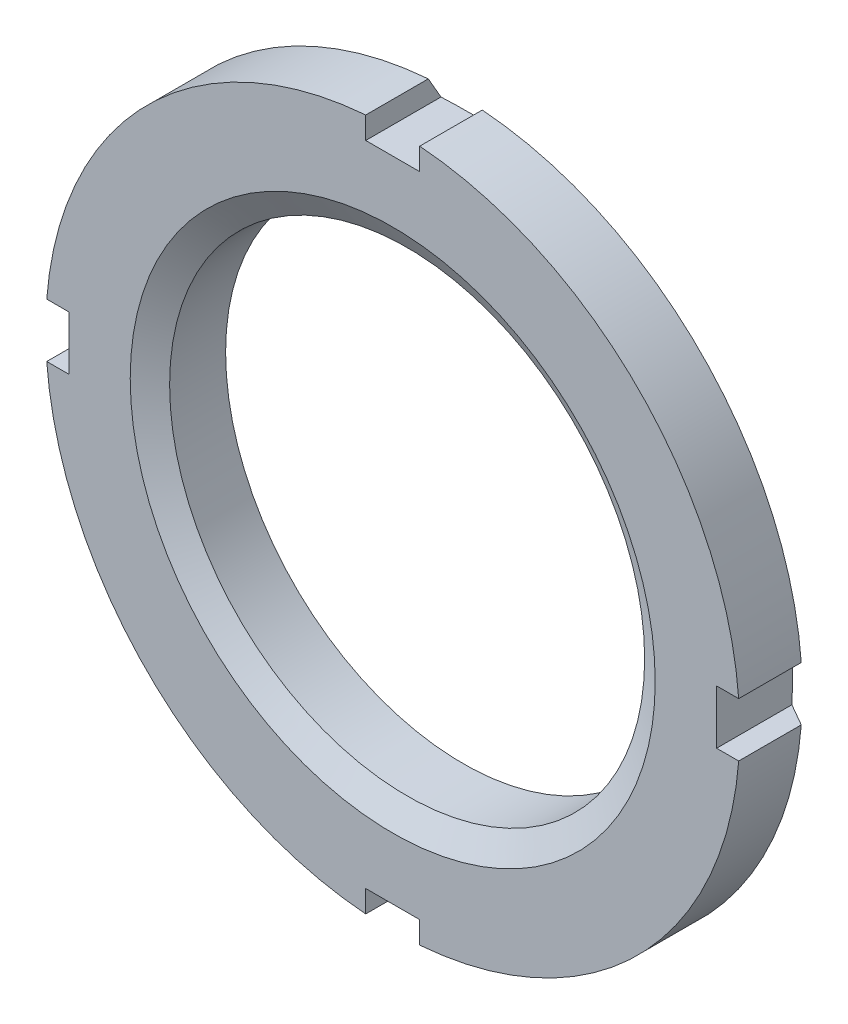
from build123d import *

# Parameters (mm, degrees)
SKICA1_R                 = 90
SKICA1_R_2               = 61.6
VYSUNOUT1_DEPTH          = 11
ZKOSIT2_SIZE             = 3.74
ZKOSIT2_SIZE2            = 6.47787002
ZKOSIT3_SIZE             = 3.74
ZKOSIT3_SIZE2            = 6.47787002
ODEBRAT_VYSUNUT_M1_REACH = 131.167
SKICA2_W                 = 14
SKICA2_H                 = 6
KRUHOV_POLE1_COUNT       = 4


with BuildPart() as part:
    # Skica1 → Vysunout1 (new, symmetric)
    with BuildSketch(Plane.XY):
        Circle(SKICA1_R)
        Circle(SKICA1_R_2, mode=Mode.SUBTRACT)
    extrude(amount=VYSUNOUT1_DEPTH, both=True)

    # Zkosit2
    zkosit2_edges = [part.edges().sort_by_distance(p)[0] for p in [
        (-61.6, 0, -11),
    ]]
    zkosit2_side = [part.faces().sort_by_distance(p)[0] for p in [
        (-61.6, 0, 0),
    ]]
    chamfer(zkosit2_edges, length=ZKOSIT2_SIZE, length2=ZKOSIT2_SIZE2, reference=zkosit2_side[0])

    # Zkosit3
    zkosit3_edges = [part.edges().sort_by_distance(p)[0] for p in [
        (-61.6, 0, 11),
    ]]
    zkosit3_side = [part.faces().sort_by_distance(p)[0] for p in [
        (-61.6, 0, 1.87),
    ]]
    chamfer(zkosit3_edges, length=ZKOSIT3_SIZE, length2=ZKOSIT3_SIZE2, reference=zkosit3_side[0])

    # Skica4 → Odebrat otočením1 (revolve, cut)
    with BuildSketch(Plane(origin=(0, 0, 0), x_dir=(1, 0, 0), z_dir=(0, 1, 0))):
        Polygon((90, 11), (80, 11), (90, 5.226497308), align=None)
    revolve(axis=Axis((0, 0, 0), (0, 0, -1)), mode=Mode.SUBTRACT)

    # Odebrat vysunutím1: up to this cone (the profile starts inside it)
    odebrat_vysunut_m1_end = Plane(origin=(0, 0, 11), z_dir=(0, 0, 1)).offset(-68.188020535) * Cone(1.732e-06, 550.723116052, 317.960138302, align=(Align.CENTER, Align.CENTER, Align.MIN), mode=Mode.PRIVATE)
    # Skica2 → Odebrat vysunutím1 (cut, up to the surface)
    with BuildSketch(Plane.XY.offset(11), mode=Mode.PRIVATE) as odebrat_vysunut_m1_sk1:
        with Locations((0, 87)):
            Rectangle(SKICA2_W, SKICA2_H)
    odebrat_vysunut_m1_tool1 = extrude(odebrat_vysunut_m1_sk1.sketch, amount=-ODEBRAT_VYSUNUT_M1_REACH, mode=Mode.PRIVATE) & odebrat_vysunut_m1_end
    odebrat_vysunut_m1 = odebrat_vysunut_m1_tool1.solids().sort_by_distance((0, 87, 11))[0]
    add(odebrat_vysunut_m1, mode=Mode.SUBTRACT)

    # Kruhové pole1: Odebrat vysunutím1 ×4 about axis
    kruhov_pole1_axis = Axis((0, 0, 0), (0, 0, 1))
    for i in range(1, KRUHOV_POLE1_COUNT):
        add(odebrat_vysunut_m1.rotate(kruhov_pole1_axis, i * 360 / KRUHOV_POLE1_COUNT), mode=Mode.SUBTRACT)


solid = part.part
